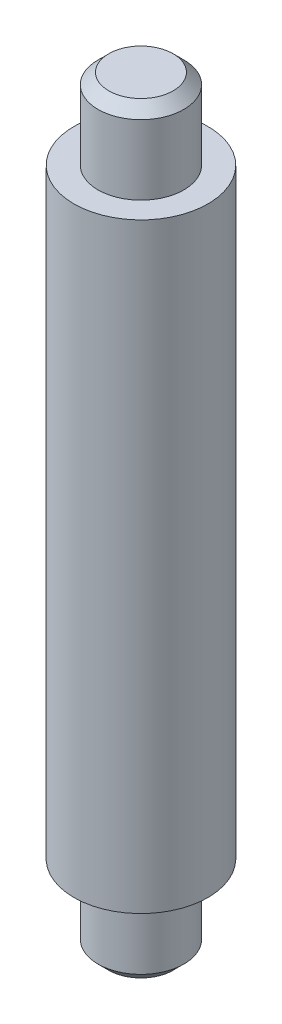
from build123d import *

# Parameters (mm, degrees)
SKETCH1_R           = 1.25
BOSS_EXTRUDE1_DEPTH = 11.2
SKETCH2_R           = 0.8
BOSS_EXTRUDE2_DEPTH = 1.5
BOSS_EXTRUDE3_START = -12.7
SKETCH2_2_R         = 0.8
BOSS_EXTRUDE3_DEPTH = 1.5
CHAMFER1_SIZE       = 0.2


with BuildPart() as part:
    # Sketch1 → Boss-Extrude1 (new body)
    with BuildSketch(Plane(origin=(0, 0, 0), x_dir=(1, 0, 0), z_dir=(0, 1, 0))):
        with Locations(Location((0, 0, 0), (0, 0, 270))):
            Circle(SKETCH1_R)
    extrude(amount=BOSS_EXTRUDE1_DEPTH)

    # Sketch2 → Boss-Extrude2 (add)
    with BuildSketch(Plane(origin=(0, 11.2, 0), x_dir=(1, 0, 0), z_dir=(0, 1, 0))):
        with Locations(Location((0, 0, 0), (0, 0, 270))):
            Circle(SKETCH2_R)
    extrude(amount=BOSS_EXTRUDE2_DEPTH)

    # Sketch2<2> → Boss-Extrude3 (add)
    with BuildSketch(Plane(origin=(0, 11.2, 0), x_dir=(1, 0, 0), z_dir=(0, 1, 0)).offset(BOSS_EXTRUDE3_START)):
        with Locations(Location((0, 0, 0), (0, 0, 270))):
            Circle(SKETCH2_2_R)
    extrude(amount=BOSS_EXTRUDE3_DEPTH)

    # Chamfer1
    chamfer1_edges = [part.edges().sort_by_distance(p)[0] for p in [
        (0, -1.5, -0.8),
        (0, 12.7, -0.8),
    ]]
    chamfer(chamfer1_edges, length=CHAMFER1_SIZE)


solid = part.part
